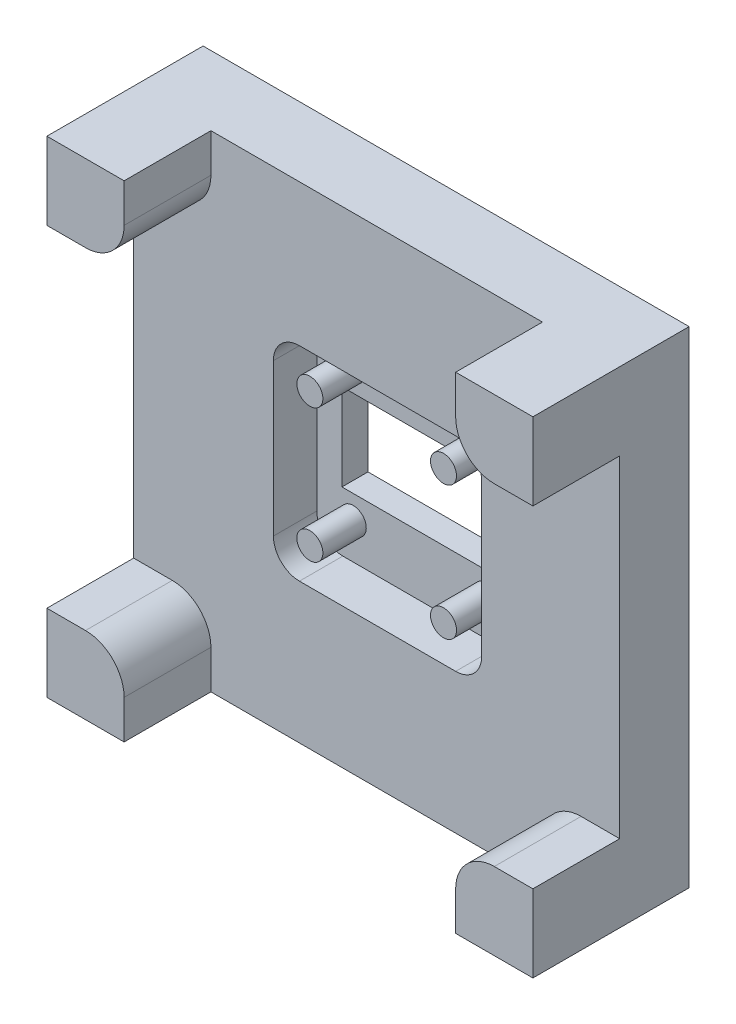
from build123d import *

# Parameters (mm, degrees)
ESBO_O1_W                = 56
ESBO_O1_H                = 56
RESSALTO_EXTRUS_O1_DEPTH = 8
RESSALTO_EXTRUS_O2_DEPTH = 10
ESPELHAR2_COPY_1_DEPTH   = 10
ESBO_O3_R                = 1.5
CORTE_EXTRUS_O1_DEPTH    = 5
ESBO_O4_W                = 18
ESBO_O4_H                = 10
CORTE_EXTRUS_O2_DEPTH    = 12


with BuildPart() as part:
    # Esboço1 → Ressalto-extrusão1 (new body)
    with BuildSketch(Plane.XY):
        Rectangle(ESBO_O1_W, ESBO_O1_H)
    extrude(amount=RESSALTO_EXTRUS_O1_DEPTH)

    # Esboço2 → Ressalto-extrusão2 (add)
    with BuildSketch(Plane.XY.offset(8)):
        with BuildLine():
            Line((-19.1, 23.55), (-19.1, 28))
            Line((-19.1, 28), (-28, 28))
            Line((-28, 28), (-28, 19.1))
            Line((-28, 19.1), (-23.55, 19.1))
            ThreePointArc((-23.55, 19.1), (-20.403374824, 20.403374824), (-19.1, 23.55))
        make_face()
    ressalto_extrus_o2 = extrude(amount=RESSALTO_EXTRUS_O2_DEPTH)

    # Espelhar1: Ressalto-extrusão2 across plane
    add(ressalto_extrus_o2.mirror(Plane(origin=(0, 0, 0), x_dir=(0, 0, 1), z_dir=(1, 0, 0))))

    # Espelhar2: Ressalto-extrusão2 across plane
    add(ressalto_extrus_o2.mirror(Plane.ZX))

    # Espelhar2 copy 1 sketch → Espelhar2 copy 1 (add)
    with BuildSketch(Plane(origin=(0, 0, 8), x_dir=(-1, 0, 0), z_dir=(0, 0, 1))):
        with BuildLine():
            Line((-19.1, 23.55), (-19.1, 28))
            Line((-19.1, 28), (-28, 28))
            Line((-28, 28), (-28, 19.1))
            Line((-28, 19.1), (-23.55, 19.1))
            ThreePointArc((-23.55, 19.1), (-20.403374824, 20.403374824), (-19.1, 23.55))
        make_face()
    extrude(amount=ESPELHAR2_COPY_1_DEPTH)

    # Esboço3 → Corte-extrusão1 (cut)
    with BuildSketch(Plane.XY.offset(8)):
        with BuildLine():
            Line((9.1, -11.85), (-8.9, -11.85))
            ThreePointArc((-8.9, -11.85), (-11.021320344, -10.971320344), (-11.9, -8.85))
            Line((-11.9, -8.85), (-11.9, 8.65))
            ThreePointArc((-11.9, 8.65), (-11.021320344, 10.771320344), (-8.9, 11.65))
            Line((-8.9, 11.65), (9.1, 11.65))
            ThreePointArc((9.1, 11.65), (11.221320344, 10.771320344), (12.1, 8.65))
            Line((12.1, 8.65), (12.1, -8.85))
            ThreePointArc((12.1, -8.85), (11.221320344, -10.971320344), (9.1, -11.85))
        make_face()
        with Locations((-7.7, 7.7)):
            Circle(ESBO_O3_R, mode=Mode.SUBTRACT)
        with Locations((7.7, 7.7)):
            Circle(ESBO_O3_R, mode=Mode.SUBTRACT)
        with Locations((7.7, -7.7)):
            Circle(ESBO_O3_R, mode=Mode.SUBTRACT)
        with Locations((-7.7, -7.7)):
            Circle(ESBO_O3_R, mode=Mode.SUBTRACT)
    extrude(amount=-CORTE_EXTRUS_O1_DEPTH, mode=Mode.SUBTRACT)

    # Esboço4 → Corte-extrusão2 (cut)
    with BuildSketch(Plane.XY.offset(3)):
        Rectangle(ESBO_O4_W, ESBO_O4_H)
    extrude(amount=-CORTE_EXTRUS_O2_DEPTH, mode=Mode.SUBTRACT)


solid = part.part
